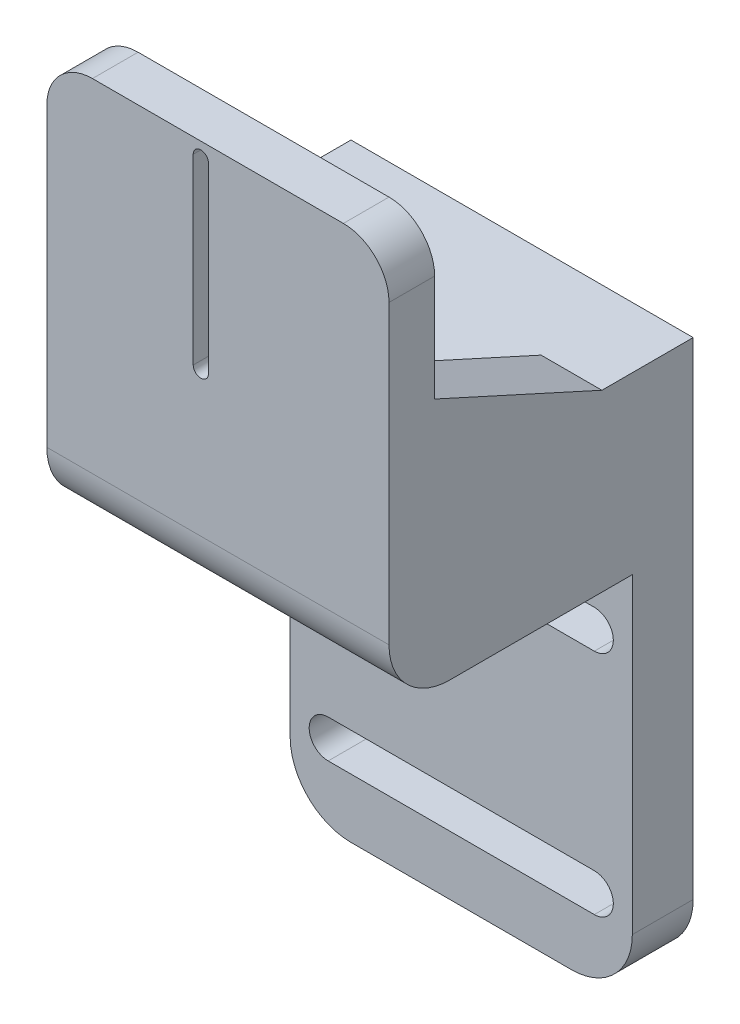
from build123d import *

# Parameters (mm, degrees)
SKETCH_1_W          = 45
SKETCH_1_H          = 72
EXTRUDE_1_DEPTH     = 8
SKETCH_3_W          = 45
SKETCH_3_H          = 23
EXTRUDE_2_DEPTH     = 32
SKETCH_4_W          = 45
SKETCH_4_H          = 6
EXTRUDE_3_DEPTH     = 30
CUT_EXTRUDE_1_DEPTH = 6
FILLET_1_R          = 8
RIB_1_REACH         = 133.568
SKETCH_7_WALL_W     = 289.301938088
SKETCH_7_WALL_H     = 8
FILLET_2_R          = 8
FILLET_3_R          = 6


with BuildPart() as part:
    # 草图1 → 凸台-拉伸1 (new body)
    with BuildSketch(Plane.XY):
        with Locations((49.020589592, -80.983410709)):
            Rectangle(SKETCH_1_W, SKETCH_1_H)
        with BuildLine():
            Line((31.520589592, -74.201396253), (66.520589592, -74.201396253))
            ThreePointArc((66.520589592, -74.201396253), (69.020589592, -76.701396253), (66.520589592, -79.201396253))
            Line((66.520589592, -79.201396253), (31.520589592, -79.201396253))
            ThreePointArc((31.520589592, -79.201396253), (29.020589592, -76.701396253), (31.520589592, -74.201396253))
        make_face(mode=Mode.SUBTRACT)
        with BuildLine():
            Line((31.520589592, -104.201396253), (66.520589592, -104.201396253))
            ThreePointArc((66.520589592, -104.201396253), (69.020589592, -106.701396253), (66.520589592, -109.201396253))
            Line((66.520589592, -109.201396253), (31.520589592, -109.201396253))
            ThreePointArc((31.520589592, -109.201396253), (29.020589592, -106.701396253), (31.520589592, -104.201396253))
        make_face(mode=Mode.SUBTRACT)
    extrude(amount=EXTRUDE_1_DEPTH)

    # 草图3 → 凸台-拉伸2 (add)
    with BuildSketch(Plane.XY.offset(8)):
        with Locations((49.020589592, -56.483410709)):
            Rectangle(SKETCH_3_W, SKETCH_3_H)
    extrude(amount=EXTRUDE_2_DEPTH)

    # 草图4 → 凸台-拉伸3 (add)
    with BuildSketch(Plane(origin=(0, -44.983410709, 0), x_dir=(1, 0, 0), z_dir=(0, 1, 0))):
        with Locations((49.020589592, -37)):
            Rectangle(SKETCH_4_W, SKETCH_4_H)
    extrude(amount=EXTRUDE_3_DEPTH)

    # 草图5 → 切除-拉伸1 (cut)
    with BuildSketch(Plane.XY.offset(40)):
        with BuildLine():
            Line((47.770589592, -16.983410709), (47.770589592, -40.983410709))
            ThreePointArc((47.770589592, -40.983410709), (46.770589592, -41.983410709), (45.770589592, -40.983410709))
            Line((45.770589592, -40.983410709), (45.770589592, -16.983410709))
            ThreePointArc((45.770589592, -16.983410709), (46.770589592, -15.983410709), (47.770589592, -16.983410709))
        make_face()
    extrude(amount=-CUT_EXTRUDE_1_DEPTH, mode=Mode.SUBTRACT)

    # 圆角1
    fillet_1_edges = [part.edges().sort_by_distance(p)[0] for p in [
        (71.520589592, -116.983410709, 4),
        (26.520589592, -116.983410709, 4),
    ]]
    fillet(fillet_1_edges, radius=FILLET_1_R)

    # 草图7 wall → 筋1 (add, up to next)
    with BuildSketch(Plane(origin=(71.520589592, -39.983410709, 23), x_dir=(0, -0.413802944301, -0.910366477463), z_dir=(0, 0.910366477463, -0.413802944301)), mode=Mode.PRIVATE) as rib_1_sk1:
        with Locations((0, 4)):
            Rectangle(SKETCH_7_WALL_W, SKETCH_7_WALL_H)
    rib_1_tool1 = extrude(rib_1_sk1.sketch, amount=-RIB_1_REACH, mode=Mode.PRIVATE) - part.part
    add(rib_1_tool1.solids().sort_by_distance((71.520589592, -39.983410709, 23))[0])

    # 圆角2
    fillet_2_edges = [part.edges().sort_by_distance(p)[0] for p in [
        (49.020589592, -67.983410709, 40),
    ]]
    fillet(fillet_2_edges, radius=FILLET_2_R)

    # 圆角3
    fillet_3_edges = [part.edges().sort_by_distance(p)[0] for p in [
        (26.520589592, -14.983410709, 37),
        (71.520589592, -14.983410709, 37),
    ]]
    fillet(fillet_3_edges, radius=FILLET_3_R)


solid = part.part
